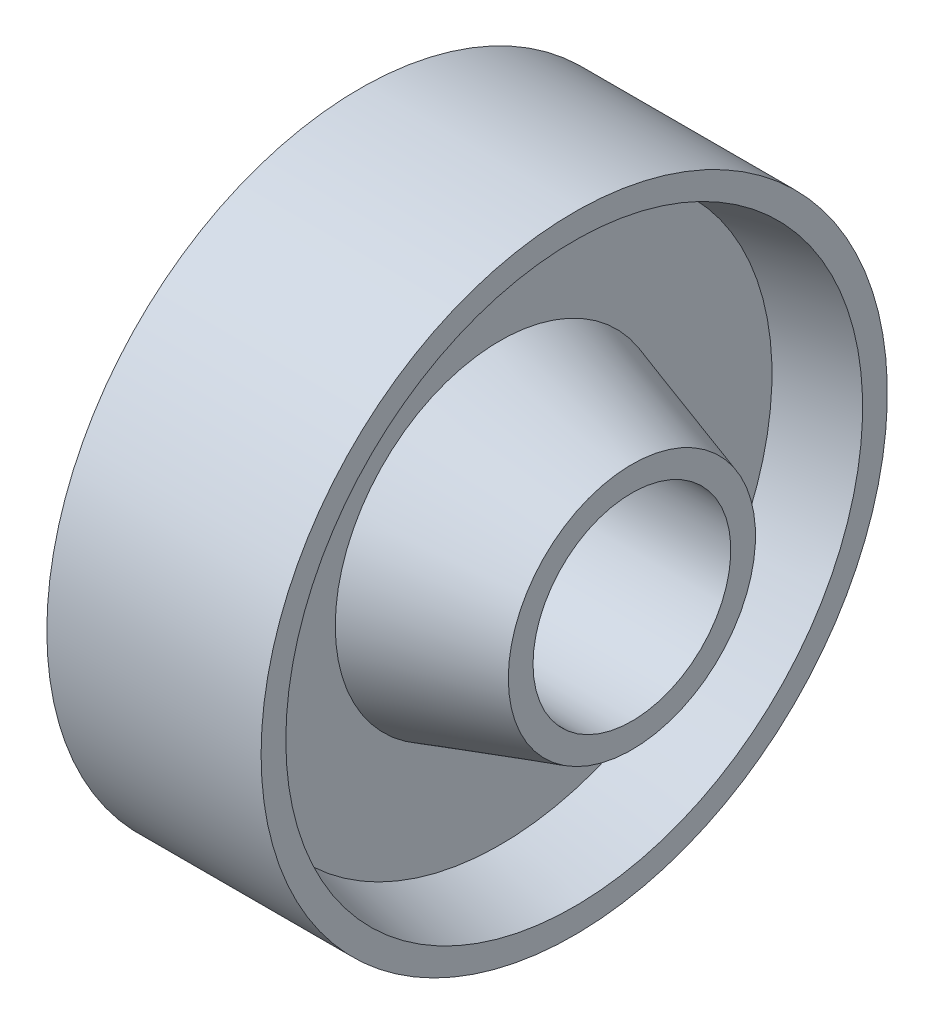
from build123d import *


with BuildPart() as part:
    # Sketch1 → Revolve1 (revolve)
    with BuildSketch(Plane.XY, mode=Mode.PRIVATE) as revolve1_sk:
        Polygon((13, 38), (-13, 38), (-13, 35), (-4, 33), (-4, 20), (-20, 15), (-20, 12), (20, 12), (20, 15), (4, 20), (4, 33), (13, 35), align=None)
    revolve(revolve1_sk.sketch.rotate(Axis((-72.537585421, 0, 0), (1, 0, 0)), 90), axis=Axis((-72.537585421, 0, 0), (1, 0, 0)))


solid = part.part
